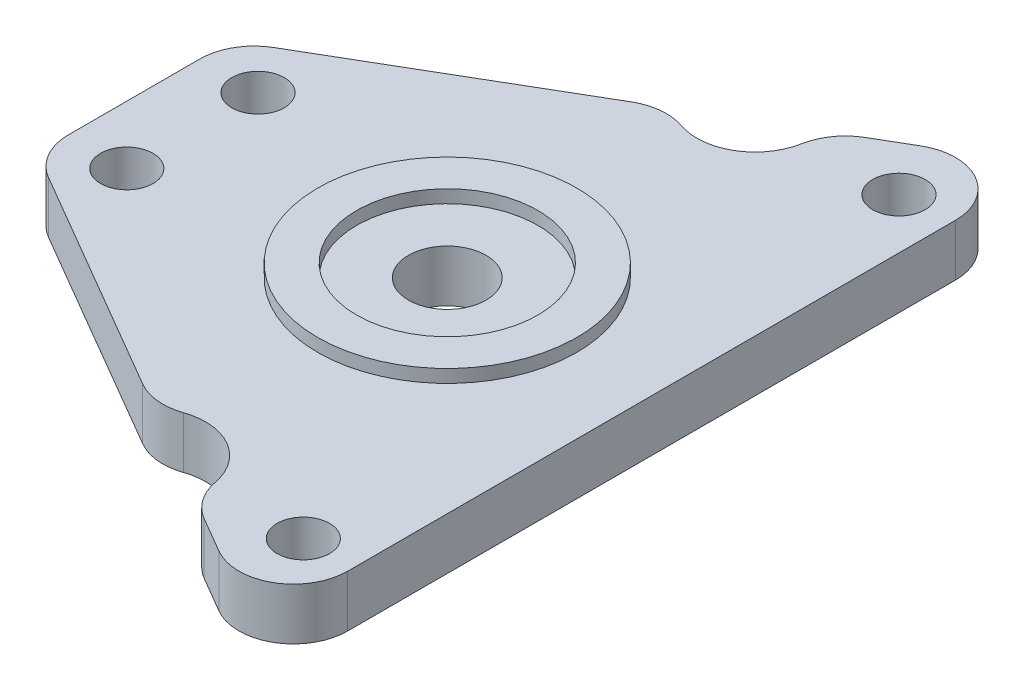
from build123d import *

# Parameters (mm, degrees)
BOSS_EXTRUDE1_DEPTH = 4
FILLET1_R           = 4.2
SKETCH3_R           = 3
SKETCH3_R_2         = 2.025
CUT_EXTRUDE1_DEPTH  = 49.76638045
SKETCH2_R           = 10
SKETCH2_R_2         = 7
BOSS_EXTRUDE2_DEPTH = 1


with BuildPart() as part:
    # Sketch1 → Boss-Extrude1 (new body)
    with BuildSketch(Plane(origin=(0, 0, 0), x_dir=(1, 0, 0), z_dir=(0, 1, 0))):
        with BuildLine():
            Line((0, -7.47801578), (0, 7.47801578))
            Line((0, 7.47801578), (21.555297549, 20.045096945))
            ThreePointArc((21.555297549, 20.045096945), (26.746562982, 19.577458446), (28.897035116, 24.325446668))
            Line((28.897035116, 24.325446668), (39.960063413, 30.775368049))
            Line((39.960063413, 30.775368049), (39.960063413, -30.775340317))
            Line((39.960063413, -30.775340317), (28.897031775, -24.325424666))
            ThreePointArc((28.897031775, -24.325424666), (26.746553125, -19.577458381), (21.555304058, -20.04508578))
            Line((21.555304058, -20.04508578), (0, -7.47801578))
        make_face()
    extrude(amount=BOSS_EXTRUDE1_DEPTH)

    # Fillet1
    fillet1_edges = [part.edges().sort_by_distance(p)[0] for p in [
        (0, 2, 7.47801578),
        (0, 2, -7.47801578),
        (21.555297549, 2, -20.045096945),
        (28.897035116, 2, -24.325446668),
        (39.960063413, 2, -30.775368049),
        (39.960063413, 2, 30.775340317),
        (28.897031775, 2, 24.325424666),
        (21.555304058, 2, 20.04508578),
    ]]
    fillet(fillet1_edges, radius=FILLET1_R)

    # Sketch3 → Cut-Extrude1 (cut, through all)
    with BuildSketch(Plane(origin=(0, 4, 0), x_dir=(1, 0, 0), z_dir=(0, 1, 0))):
        with Locations(Location((24.18, 0, 0), (0, 0, 270))):
            Circle(SKETCH3_R)
        with Locations(Location((36.06, -22.995, 0), (0, 0, 270))):
            Circle(SKETCH3_R_2)
        with Locations(Location((36.06, 22.995, 0), (0, 0, 270))):
            Circle(SKETCH3_R_2)
        with Locations(Location((4.5, 5.065, 0), (0, 0, 270))):
            Circle(SKETCH3_R_2)
        with Locations(Location((4.5, -5.065, 0), (0, 0, 270))):
            Circle(SKETCH3_R_2)
    extrude(amount=-CUT_EXTRUDE1_DEPTH, mode=Mode.SUBTRACT)

    # Sketch2 → Boss-Extrude2 (add)
    with BuildSketch(Plane(origin=(0, 4, 0), x_dir=(1, 0, 0), z_dir=(0, 1, 0))):
        with Locations(Location((24.18, 0, 0), (0, 0, 270))):
            Circle(SKETCH2_R)
        with Locations(Location((24.18, 0, 0), (0, 0, 270))):
            Circle(SKETCH2_R_2, mode=Mode.SUBTRACT)
    extrude(amount=BOSS_EXTRUDE2_DEPTH)


solid = part.part
